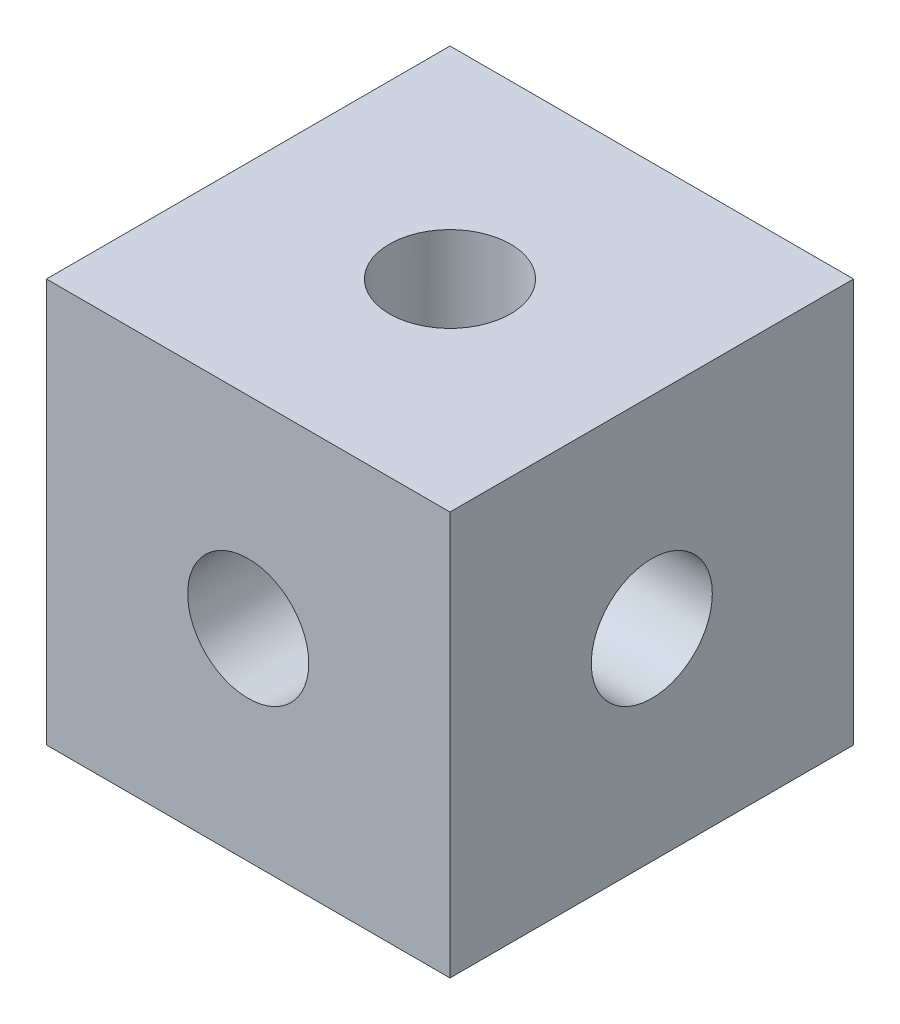
from build123d import *

# Parameters (mm, degrees)
SKETCH_1_W          = 10
SKETCH_1_H          = 10
SKETCH_1_R          = 1.5
EXTRUDE_1_DEPTH     = 10
SKETCH_2_R          = 1.5
CUT_EXTRUDE_1_DEPTH = 16
SKETCH_3_R          = 1.5
CUT_EXTRUDE_2_DEPTH = 16


with BuildPart() as part:
    # 草图1 → 凸台-拉伸1 (new body)
    with BuildSketch(Plane(origin=(0, 0, 0), x_dir=(1, 0, 0), z_dir=(0, 1, 0))):
        Rectangle(SKETCH_1_W, SKETCH_1_H)
        with Locations(Location((0, 0, 0), (0, 0, 270))):
            Circle(SKETCH_1_R, mode=Mode.SUBTRACT)
    extrude(amount=EXTRUDE_1_DEPTH)

    # 草图2 → 切除-拉伸1 (cut, through all)
    with BuildSketch(Plane(origin=(5, 0, 0), x_dir=(0, 0, -1), z_dir=(1, 0, 0))):
        with Locations((0, 5)):
            Circle(SKETCH_2_R)
    extrude(amount=-CUT_EXTRUDE_1_DEPTH, mode=Mode.SUBTRACT)

    # 草图3 → 切除-拉伸2 (cut, through all)
    with BuildSketch(Plane.XY.offset(5)):
        with Locations((0, 5)):
            Circle(SKETCH_3_R)
    extrude(amount=-CUT_EXTRUDE_2_DEPTH, mode=Mode.SUBTRACT)


solid = part.part
